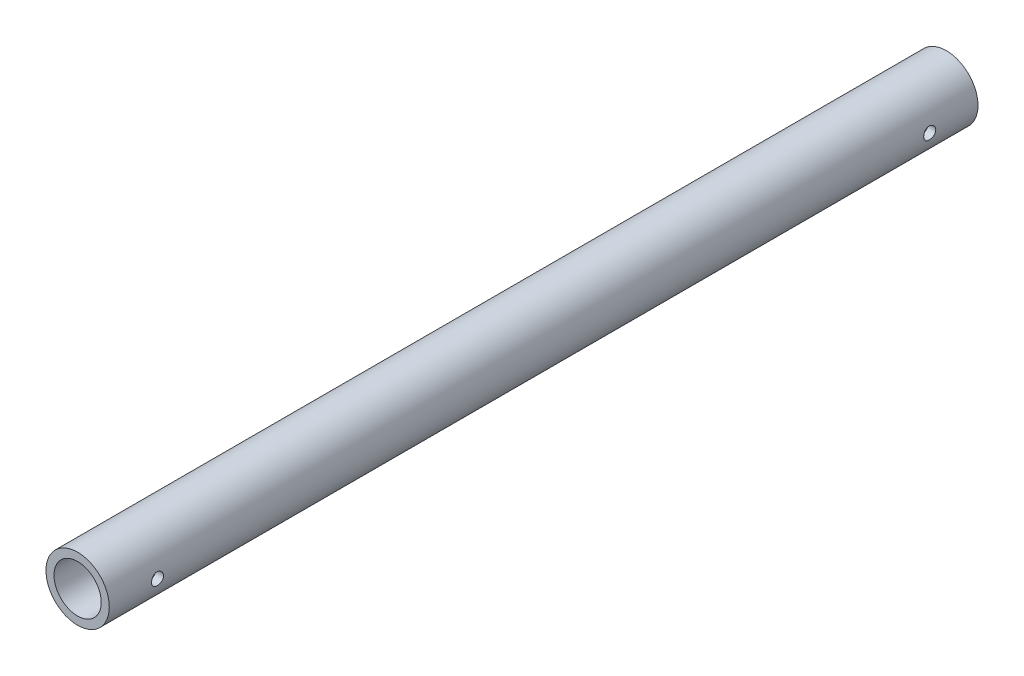
from build123d import *

# Parameters (mm, degrees)
SKETCH1_R               = 25
SKETCH1_R_2             = 18.65
BOSS_EXTRUDE1_DEPTH     = 685.8
CUT_EXTRUDE1_DEPTH      = 687.710739686
CUT_EXTRUDE1_DEPTH_BACK = 687.710739686
SKETCH2_R               = 4.7625


with BuildPart() as part:
    # Sketch1 → Boss-Extrude1 (new body)
    with BuildSketch(Plane.XY):
        Circle(SKETCH1_R)
        Circle(SKETCH1_R_2, mode=Mode.SUBTRACT)
    extrude(amount=BOSS_EXTRUDE1_DEPTH)

    # Sketch2 → Cut-Extrude1 (cut, two sides: drawn at the far end of the back side and taken through both)
    with BuildSketch(Plane(origin=(0, 0, 0), x_dir=(0, 0, -1), z_dir=(1, 0, 0)).offset(-CUT_EXTRUDE1_DEPTH_BACK)):
        with Locations((-647.7, 0)):
            Circle(SKETCH2_R)
        with Locations((-38.1, 0)):
            Circle(SKETCH2_R)
    extrude(amount=CUT_EXTRUDE1_DEPTH + CUT_EXTRUDE1_DEPTH_BACK, mode=Mode.SUBTRACT)


solid = part.part
